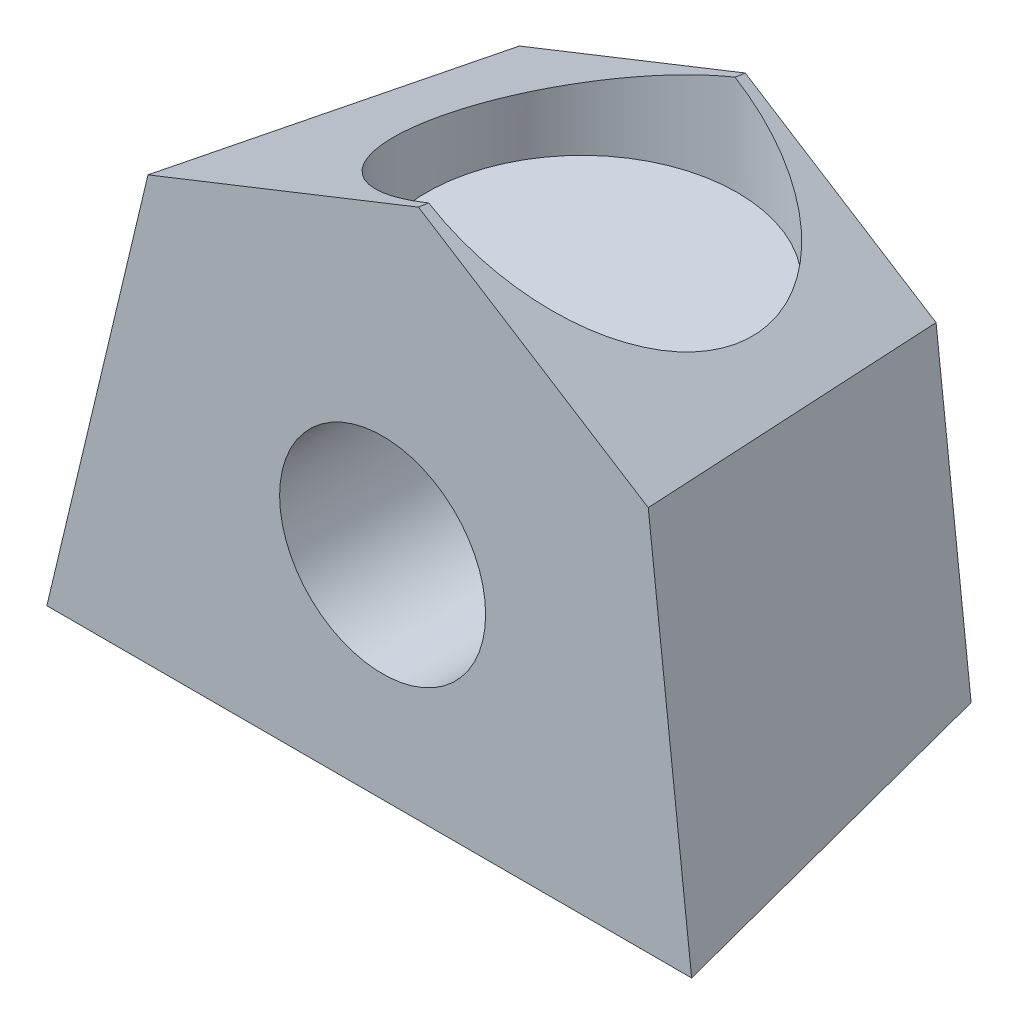
from build123d import *

# Parameters (mm, degrees)
BOSS_EXTRUDE1_DEPTH = 24
BOSS_EXTRUDE1_DRAFT = -8
SCALE1_SCALE        = 4
SKETCH3_R           = 45
CUT_EXTRUDE1_DEPTH  = 88
SKETCH4_R           = 29.815
CUT_EXTRUDE2_DEPTH  = 96


with BuildPart() as part:
    # Sketch1 → Boss-Extrude1 (with draft: the straight prism first)
    with BuildSketch(Plane.XY):
        Polygon((-53.266019417, 16.909847434), (-59.184466019, -7.891262136), (-20.573647712, -7.891262136), (-23.110124827, 14.65520111), (-36.919833564, 23.391955617), align=None)
    extrude(amount=BOSS_EXTRUDE1_DEPTH)
    # Boss-Extrude1: the draft: its side faces are tilted about the plane it starts from
    boss_extrude1_sides = [part.faces().sort_by_distance(p)[0] for p in [
        (-56.225242718, 4.509292649, 12),
        (-39.879056865, -7.891262136, 12),
        (-21.841886269, 3.381969487, 12),
        (-30.014979196, 19.023578363, 12),
        (-45.092926491, 20.150901526, 12),
    ]]
    draft(boss_extrude1_sides, Plane.XY, BOSS_EXTRUDE1_DRAFT)


with BuildPart() as part_1:
    # Scale1: scaled about (-39.217709301, 5.154172018, 12.784931537)
    add(part.part.scale(SCALE1_SCALE).moved(Location((117.653127903, -15.462516054, -38.354794611))))

    # Sketch3 → Cut-Extrude1 (cut)
    with BuildSketch(Plane(origin=(0, 138, 0), x_dir=(1, 0, 0), z_dir=(0, 1, 0))):
        with Locations(Location((-29.321171046, -9.645205389, 0), (0, 0, 270))):
            Circle(SKETCH3_R)
    extrude(amount=-CUT_EXTRUDE1_DEPTH, mode=Mode.SUBTRACT)

    # Sketch4 → Cut-Extrude2 (cut)
    with BuildSketch(Plane.XY.offset(57.645205389)):
        with Locations((-38.993157732, 0.806531709)):
            Circle(SKETCH4_R)
    extrude(amount=-CUT_EXTRUDE2_DEPTH, mode=Mode.SUBTRACT)


solid = part_1.part
